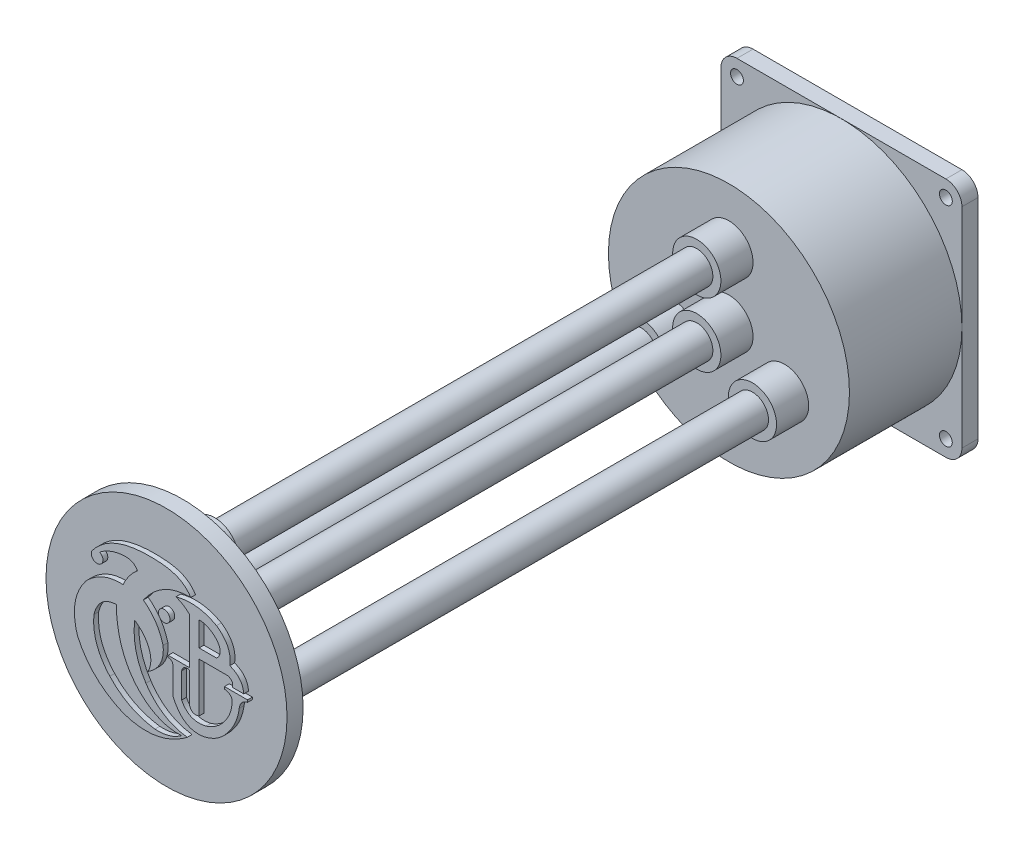
from build123d import *

# Parameters (mm, degrees)
ESQUISSE1_R        = 75
BOSS_EXTRU_1_DEPTH = 70
ESQUISSE2_R        = 15
BOSS_EXTRU_2_DEPTH = 20
ESQUISSE3_R        = 4
BOSS_EXTRU_3_DEPTH = 10
ESQUISSE4_R        = 10
BOSS_EXTRU_4_DEPTH = 300
ESQUISSE5_R        = 15
BOSS_EXTRU_5_DEPTH = 20
ESQUISSE6_R        = 75
BOSS_EXTRU_6_DEPTH = 10
ESQUISSE7_R        = 3.576433544
BOSS_EXTRU_7_DEPTH = 3


with BuildPart() as part:
    # Esquisse1 → Boss.-Extru.1 (new body)
    with BuildSketch(Plane.XY):
        Circle(ESQUISSE1_R)
    extrude(amount=BOSS_EXTRU_1_DEPTH)

    # Esquisse2 → Boss.-Extru.2 (add)
    with BuildSketch(Plane.XY.offset(70)):
        Circle(ESQUISSE2_R)
        with Locations((0, 40)):
            Circle(ESQUISSE2_R)
        with Locations((34.641016151, -20)):
            Circle(ESQUISSE2_R)
        with Locations((-34.641016151, -20)):
            Circle(ESQUISSE2_R)
    extrude(amount=BOSS_EXTRU_2_DEPTH)

    # Esquisse3 → Boss.-Extru.3 (add)
    with BuildSketch(Plane(origin=(0, 0, 0), x_dir=(-1, 0, 0), z_dir=(0, 0, -1))):
        with BuildLine():
            Line((-65, -75.028249058), (65, -75.028249058))
            ThreePointArc((65, -75.028249058), (72.071067812, -72.09931687), (75, -65.028249058))
            Line((75, -65.028249058), (75, 65.028249058))
            ThreePointArc((75, 65.028249058), (72.071067812, 72.09931687), (65, 75.028249058))
            Line((65, 75.028249058), (-65, 75.028249058))
            ThreePointArc((-65, 75.028249058), (-72.071067812, 72.09931687), (-75, 65.028249058))
            Line((-75, 65.028249058), (-75, -65.028249058))
            ThreePointArc((-75, -65.028249058), (-72.071067812, -72.09931687), (-65, -75.028249058))
        make_face()
        with Locations((-65, 65.028249058)):
            Circle(ESQUISSE3_R, mode=Mode.SUBTRACT)
        with Locations((65, 65.028249058)):
            Circle(ESQUISSE3_R, mode=Mode.SUBTRACT)
        with Locations((65, -65.028249058)):
            Circle(ESQUISSE3_R, mode=Mode.SUBTRACT)
        with Locations((-65, -65.028249058)):
            Circle(ESQUISSE3_R, mode=Mode.SUBTRACT)
    extrude(amount=BOSS_EXTRU_3_DEPTH)

    # Esquisse4 → Boss.-Extru.4 (add)
    with BuildSketch(Plane.XY.offset(90)):
        Circle(ESQUISSE4_R)
        with Locations((34.641016151, -20)):
            Circle(ESQUISSE4_R)
        with Locations((0, 40)):
            Circle(ESQUISSE4_R)
        with Locations((-34.641016151, -20)):
            Circle(ESQUISSE4_R)
    extrude(amount=BOSS_EXTRU_4_DEPTH)

    # Esquisse5 → Boss.-Extru.5 (add)
    with BuildSketch(Plane.XY.offset(390)):
        Circle(ESQUISSE5_R)
        with Locations((34.641016151, -20)):
            Circle(ESQUISSE5_R)
        with Locations((0, 40)):
            Circle(ESQUISSE5_R)
        with Locations((-34.641016151, -20)):
            Circle(ESQUISSE5_R)
    extrude(amount=BOSS_EXTRU_5_DEPTH)

    # Esquisse6 → Boss.-Extru.6 (add)
    with BuildSketch(Plane.XY.offset(410)):
        Circle(ESQUISSE6_R)
    extrude(amount=BOSS_EXTRU_6_DEPTH)

    # Esquisse7 → Boss.-Extru.7 (add)
    # profile 1 of 3: a face of its own
    with BuildSketch(Plane.XY.offset(420)):
        with Locations((1.551261471, 19.273695099)):
            Circle(ESQUISSE7_R)
    # profile 2 of 3: a face of its own
    with BuildSketch(Plane.XY.offset(420)):
        with BuildLine():
            Line((53.407129338, 0), (39.04859836, 0))
            Line((39.04859836, 0), (39.04859836, -1.387658538))
            add(Edge.make_bspline(
                [(43.841704676, -4.803008424), (42.677068575, -1.534983383), (39.04859836, -1.387658538)],
                knots=[0, 0, 0, 1, 1, 1], degree=2))
            add(Edge.make_bspline(
                [(41.075081213, -15.718632331), (43.913779943, -10.636802195), (43.841704676, -4.803008424)],
                knots=[0, 0, 0, 1, 1, 1], degree=2))
            add(Edge.make_bspline(
                [(27.569675457, -27.083162411), (36.441568123, -24.113433854), (41.075081213, -15.718632331)],
                knots=[0, 0, 0, 1, 1, 1], degree=2))
            add(Edge.make_bspline(
                [(12.395747589, -20.631060779), (17.082635572, -29.566429351), (27.569675457, -27.083162411)],
                knots=[0, 0, 0, 1, 1, 1], degree=2))
            Line((12.395747589, -20.631060779), (12.395747589, -4.803008424))
            add(Edge.make_bspline(
                [(12.395747589, -4.803008424), (13.286296529, -1.207181167), (17.25069793, -1.936589201)],
                knots=[0, 0, 0, 1, 1, 1], degree=2))
            Line((17.25069793, -1.936589201), (17.25069793, -20.631060779))
            add(Edge.make_bspline(
                [(17.25069793, -20.631060779), (18.578276141, -25.36358533), (23.25069793, -23.768152237)],
                knots=[0, 0, 0, 1, 1, 1], degree=2))
            Line((23.25069793, -23.768152237), (23.25069793, 6.889787009))
            Line((23.25069793, 6.889787009), (41.075081213, 6.889787009))
            add(Edge.make_bspline(
                [(41.075081213, 6.889787009), (45.01943379, 5.73765885), (43.915975321, 2.041554756)],
                knots=[0, 0, 0, 1, 1, 1], degree=2))
            Line((43.915975321, 2.041554756), (51.045728634, 2.041554756))
            add(Edge.make_bspline(
                [(51.045728634, 2.041554756), (50.4252406, 9.867516747), (42.397052675, 12.889787009)],
                knots=[0, 0, 0, 1, 1, 1], degree=2))
            add(Edge.make_bspline(
                [(42.397052675, 12.889787009), (43.9337249, 23.571088111), (34.087922966, 30.351620606)],
                knots=[0, 0, 0, 1, 1, 1], degree=2))
            add(Edge.make_bspline(
                [(34.087922966, 30.351620606), (22.289440321, 36.965523758), (8.822416905, 33.248924201)],
                knots=[0, 0, 0, 1, 1, 1], degree=2))
            add(Edge.make_bspline(
                [(8.822416905, 33.248924201), (13.676665988, 31.673376824), (17.25069793, 27.993856816)],
                knots=[0, 0, 0, 1, 1, 1], degree=2))
            Line((17.25069793, 27.993856816), (17.25069793, -0.693829269))
            Line((17.25069793, -0.693829269), (4.047885286, -0.693829269))
            Line((4.047885286, -0.693829269), (4.047885286, -1.858571796))
            add(Edge.make_bspline(
                [(6.983597789, -4.803008424), (6.830489466, -1.871434339), (4.047885286, -1.858571796)],
                knots=[0, 0, 0, 1, 1, 1], degree=2))
            Line((6.983597789, -4.803008424), (6.983597789, -21.280808092))
            add(Edge.make_bspline(
                [(26.930710865, -33.268255854), (13.697816748, -36.192837409), (6.983597789, -21.280808092)],
                knots=[0, 0, 0, 1, 1, 1], degree=2))
            add(Edge.make_bspline(
                [(41.075081213, -23.768152237), (35.827824465, -31.094278488), (26.930710865, -33.268255854)],
                knots=[0, 0, 0, 1, 1, 1], degree=2))
            add(Edge.make_bspline(
                [(48.22041809, -7.183569524), (47.022064633, -16.532068109), (41.075081213, -23.768152237)],
                knots=[0, 0, 0, 1, 1, 1], degree=2))
            add(Edge.make_bspline(
                [(53.407129338, -1.387658538), (48.924492816, -2.341038165), (48.22041809, -7.183569524)],
                knots=[0, 0, 0, 1, 1, 1], degree=2))
            Line((53.407129338, -1.387658538), (53.407129338, 0))
        make_face()
        with BuildLine():
            Line((23.25069793, 27.993856816), (23.25069793, 12.889787009))
            Line((23.25069793, 12.889787009), (34.087922966, 12.889787009))
            add(Edge.make_bspline(
                [(23.25069793, 27.993856816), (29.865943002, 28.642461683), (41.400089747, 19.284469069), (34.087922966, 12.889787009)],
                knots=[0, 0, 0, 0, 1, 1, 1, 1], degree=3))
        make_face(mode=Mode.SUBTRACT)
    # profile 3 of 3: a face of its own
    with BuildSketch(Plane.XY.offset(420)):
        with BuildLine():
            ThreePointArc((-43.55860549, 31.750275589), (-38.870809206, 26.954808907), (-38.657543852, 33.657528697))
            add(Edge.make_bspline(
                [(-22.419984414, 39.284963654), (-28.23636354, 39.185912565), (-33.662886461, 37.354902565), (-38.53487095, 33.749698019), (-38.657543852, 33.657528697)],
                knots=[0, 0, 0, 0, 1, 1.025906, 1.025906, 1.025906, 1.025906], degree=3))
            add(Edge.make_bspline(
                [(-15.120483651, 35.264948741), (-17.245154505, 39.431049168), (-22.419984414, 39.284963654)],
                knots=[0, 0, 0, 1, 1, 1], degree=2))
            add(Edge.make_bspline(
                [(-15.120483651, 35.264948741), (-20.939745816, 30.39365513), (-24.006832406, 23.416483734)],
                knots=[0, 0, 0, 1, 1, 1], degree=2))
            add(Edge.make_bspline(
                [(-24.006832406, 23.416483734), (-37.244385625, 24.07903748), (-47.112054731, 13.844564669)],
                knots=[0, 0, 0, 1, 1, 1], degree=2))
            add(Edge.make_bspline(
                [(-47.112054731, 13.844564669), (-57.990639202, -0.005782483), (-52.427985456, -18.278084164)],
                knots=[0, 0, 0, 1, 1, 1], degree=2))
            add(Edge.make_bspline(
                [(-52.427985456, -18.278084164), (-43.949835958, -37.270194753), (-24.006832406, -45.774320522)],
                knots=[0, 0, 0, 1, 1, 1], degree=2))
            add(Edge.make_bspline(
                [(-24.006832406, -45.774320522), (-2.950877576, -53.133791039), (15.90362172, -38.933580445)],
                knots=[0, 0, 0, 1, 1, 1], degree=2))
            add(Edge.make_bspline(
                [(15.90362172, -38.933580445), (-0.31583397, -36.940229929), (-9.831023817, -22.650279162)],
                knots=[0, 0, 0, 1, 1, 1], degree=2))
            add(Edge.make_bspline(
                [(-9.831023817, -22.650279162), (-18.796304212, -8.914515436), (-16.813121509, 7.812887992)],
                knots=[0, 0, 0, 1, 1, 1], degree=2))
            add(Edge.make_bspline(
                [(-16.813121509, 7.812887992), (-9.386972322, 3.046001116), (-3.696387715, -6.823482952), (-8.603262743, -15.718632331)],
                knots=[0, 0, 0, 0, 1, 1, 1, 1], degree=3))
            add(Edge.make_bspline(
                [(0.856961795, 3.031616836), (2.113980998, -8.87886645), (-8.603262743, -15.718632331)],
                knots=[0, 0, 0, 1, 1, 1], degree=2))
            add(Edge.make_bspline(
                [(-11.415127287, 21.422978562), (-2.081184108, 14.327772267), (0.856961795, 3.031616836)],
                knots=[0, 0, 0, 1, 1, 1], degree=2))
            add(Edge.make_bspline(
                [(18.088963001, 37.508039833), (-0.197317297, 37.709486512), (-11.415127287, 21.422978562)],
                knots=[0, 0, 0, 1, 1, 1], degree=2))
            add(Edge.make_bspline(
                [(18.088963001, 37.508039833), (13.02991199, 45.334787252), (-2.747259835, 47.752955062), (-26.019347859, 46.209471337), (-38.373411065, 38.653634643), (-43.55860549, 31.750275589)],
                knots=[0, 0, 0, 0, 0.363060142, 0.660598782, 0.993991629, 0.993991629, 0.993991629, 0.993991629], degree=3))
        make_face()
        with BuildLine():
            add(Edge.make_bspline(
                [(-28.284364761, 10.565741082), (-28.13706299, -0.917587486), (-22.88237336, -25.686178455), (-0.433898391, -40.807847219), (12.395747589, -39.770674099)],
                knots=[0, 0, 0, 0, 0.484411619, 1, 1, 1, 1], degree=3))
            add(Edge.make_bspline(
                [(12.395747589, -39.770674099), (5.071130676, -45.205343899), (-4.218262082, -44.569489545)],
                knots=[0, 0, 0, 1, 1, 1], degree=2))
            add(Edge.make_bspline(
                [(-32.281915044, -30.129092392), (-21.127034899, -42.232683617), (-4.218262082, -44.569489545)],
                knots=[0, 0, 0, 1, 1, 1], degree=2))
            add(Edge.make_bspline(
                [(-42.210309459, -1.858571796), (-43.632293423, -17.67742367), (-32.281915044, -30.129092392)],
                knots=[0, 0, 0, 1, 1, 1], degree=2))
            add(Edge.make_bspline(
                [(-28.284364761, 10.565741082), (-39.107854138, 10.219768916), (-42.210309459, -1.858571796)],
                knots=[0, 0, 0, 1, 1, 1], degree=2))
        make_face(mode=Mode.SUBTRACT)
    extrude(amount=BOSS_EXTRU_7_DEPTH)


solid = part.part
